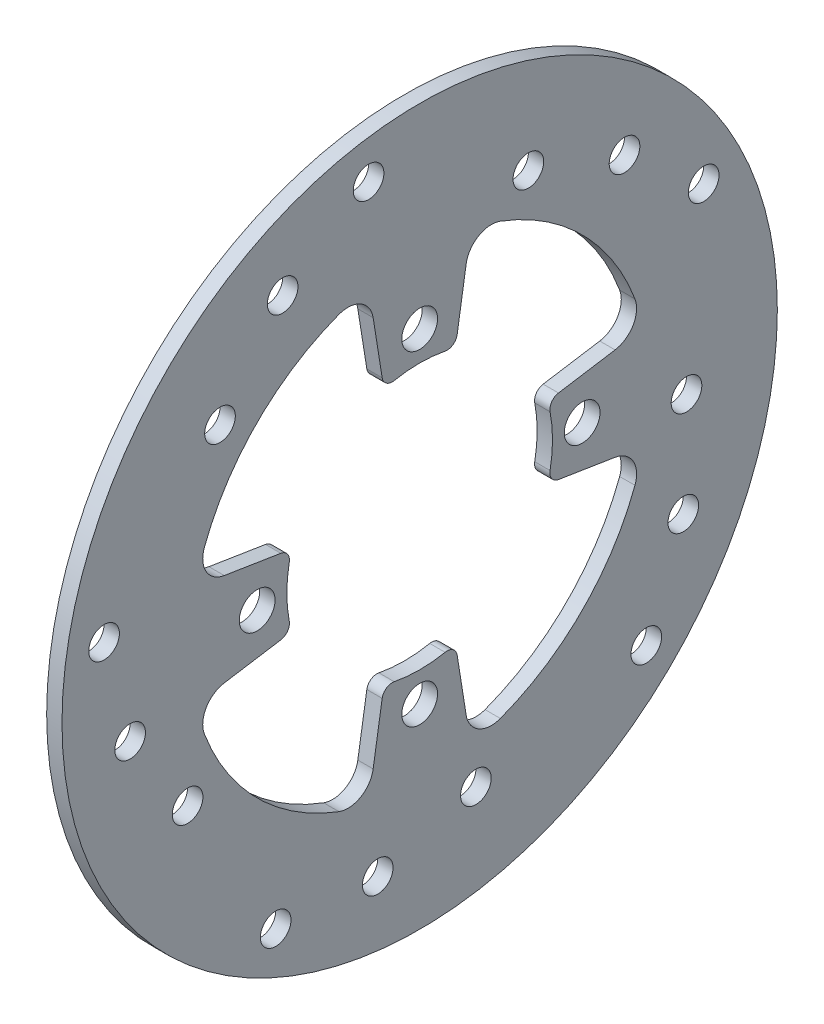
from build123d import *

# Parameters (mm, degrees)
SKETCH1_R           = 88.9
BOSS_EXTRUDE2_DEPTH = 3.81
CUT_EXTRUDE1_DEPTH  = 126.781302665
SKETCH4_R           = 4.445
CUT_EXTRUDE2_DEPTH  = 126.781302665
SKETCH5_R           = 3.81
CUT_EXTRUDE3_DEPTH  = 126.781302665


with BuildPart() as part:
    # Sketch1 → Boss-Extrude2 (new body)
    with BuildSketch(Plane(origin=(0, 0, 0), x_dir=(0, 0, -1), z_dir=(1, 0, 0))):
        with Locations(Location((0, 0, 0), (0, 0, 180))):
            Circle(SKETCH1_R)
    extrude(amount=BOSS_EXTRUDE2_DEPTH)

    # Sketch3 → Cut-Extrude1 (cut, through all)
    with BuildSketch(Plane(origin=(3.81, 0, 0), x_dir=(0, 0, -1), z_dir=(1, 0, 0))):
        with BuildLine():
            Line((9.320240363, 34.501930882), (11.560431238, 48.566486821))
            ThreePointArc((11.560431238, 48.566486821), (14.63716777, 53.055777419), (20.060305751, 53.513611663))
            ThreePointArc((20.060305751, 53.513611663), (40.411152545, 40.411152545), (53.513611663, 20.060305751))
            ThreePointArc((53.513611663, 20.060305751), (53.055777419, 14.63716777), (48.566486821, 11.560431238))
            Line((48.566486821, 11.560431238), (34.501930882, 9.320240363))
            ThreePointArc((34.501930882, 9.320240363), (32.819625412, 8.267039897), (32.408501994, 6.325298295))
            ThreePointArc((32.408501994, 6.325298295), (33.02, 0), (32.408501994, -6.325298295))
            ThreePointArc((32.408501994, -6.325298295), (32.819625412, -8.267039897), (34.501930882, -9.320240363))
            Line((34.501930882, -9.320240363), (48.566486821, -11.560431238))
            ThreePointArc((48.566486821, -11.560431238), (53.055777419, -14.63716777), (53.513611663, -20.060305751))
            ThreePointArc((53.513611663, -20.060305751), (40.411152545, -40.411152545), (20.060305751, -53.513611663))
            ThreePointArc((20.060305751, -53.513611663), (14.63716777, -53.055777419), (11.560431238, -48.566486821))
            Line((11.560431238, -48.566486821), (9.320240363, -34.501930882))
            ThreePointArc((9.320240363, -34.501930882), (8.267039897, -32.819625412), (6.325298295, -32.408501994))
            ThreePointArc((6.325298295, -32.408501994), (0, -33.02), (-6.325298295, -32.408501994))
            ThreePointArc((-6.325298295, -32.408501994), (-8.267039897, -32.819625412), (-9.320240363, -34.501930882))
            Line((-9.320240363, -34.501930882), (-11.560431238, -48.566486821))
            ThreePointArc((-11.560431238, -48.566486821), (-14.63716777, -53.055777419), (-20.060305751, -53.513611663))
            ThreePointArc((-20.060305751, -53.513611663), (-40.411152545, -40.411152545), (-53.513611663, -20.060305751))
            ThreePointArc((-53.513611663, -20.060305751), (-53.055777419, -14.63716777), (-48.566486821, -11.560431238))
            Line((-48.566486821, -11.560431238), (-34.501930882, -9.320240363))
            ThreePointArc((-34.501930882, -9.320240363), (-32.819625412, -8.267039897), (-32.408501994, -6.325298295))
            ThreePointArc((-32.408501994, -6.325298295), (-33.02, 0), (-32.408501994, 6.325298295))
            ThreePointArc((-32.408501994, 6.325298295), (-32.819625412, 8.267039897), (-34.501930882, 9.320240363))
            Line((-34.501930882, 9.320240363), (-48.566486821, 11.560431238))
            ThreePointArc((-48.566486821, 11.560431238), (-53.055777419, 14.63716777), (-53.513611663, 20.060305751))
            ThreePointArc((-53.513611663, 20.060305751), (-40.411152545, 40.411152545), (-20.060305751, 53.513611663))
            ThreePointArc((-20.060305751, 53.513611663), (-14.63716777, 53.055777419), (-11.560431238, 48.566486821))
            Line((-11.560431238, 48.566486821), (-9.320240363, 34.501930882))
            ThreePointArc((-9.320240363, 34.501930882), (-8.267039897, 32.819625412), (-6.325298295, 32.408501994))
            ThreePointArc((-6.325298295, 32.408501994), (0, 33.02), (6.325298295, 32.408501994))
            ThreePointArc((6.325298295, 32.408501994), (8.267039897, 32.819625412), (9.320240363, 34.501930882))
        make_face()
    extrude(amount=-CUT_EXTRUDE1_DEPTH, mode=Mode.SUBTRACT)

    # Sketch4 → Cut-Extrude2 (cut, through all)
    with BuildSketch(Plane.ZY):
        with Locations((0, 40.386)):
            Circle(SKETCH4_R)
        with Locations((40.386, 0)):
            Circle(SKETCH4_R)
        with Locations((0, -40.386)):
            Circle(SKETCH4_R)
        with Locations((-40.386, 0)):
            Circle(SKETCH4_R)
    extrude(amount=-CUT_EXTRUDE2_DEPTH, mode=Mode.SUBTRACT)

    # Sketch5 → Cut-Extrude3 (cut, through all)
    with BuildSketch(Plane(origin=(3.81, 0, 0), x_dir=(0, 0, -1), z_dir=(1, 0, 0))):
        with Locations((-12.7, 78.352413013)):
            Circle(SKETCH5_R)
        with Locations((-34.053975265, 64.598586623)):
            Circle(SKETCH5_R)
        with Locations((-49.624372091, 44.530633496)):
            Circle(SKETCH5_R)
        with Locations((70.593057135, 36.290644928)):
            Circle(SKETCH5_R)
        with Locations((50.913649668, 52.349316161)):
            Circle(SKETCH5_R)
        with Locations((27.01637485, 60.956304965)):
            Circle(SKETCH5_R)
        with Locations((56.328908679, -55.923560974)):
            Circle(SKETCH5_R)
        with Locations((65.520341251, -32.244929948)):
            Circle(SKETCH5_R)
        with Locations((66.321410001, -6.857565199)):
            Circle(SKETCH5_R)
        with Locations((-35.779877022, -70.853306382)):
            Circle(SKETCH5_R)
        with Locations((-10.41985182, -72.277778833)):
            Circle(SKETCH5_R)
        with Locations((13.972510712, -65.194513338)):
            Circle(SKETCH5_R)
        with Locations((-78.442088792, 12.133809414)):
            Circle(SKETCH5_R)
        with Locations((-71.960163834, -12.425194003)):
            Circle(SKETCH5_R)
        with Locations((-57.685923473, -33.434859923)):
            Circle(SKETCH5_R)
    extrude(amount=-CUT_EXTRUDE3_DEPTH, mode=Mode.SUBTRACT)


solid = part.part
